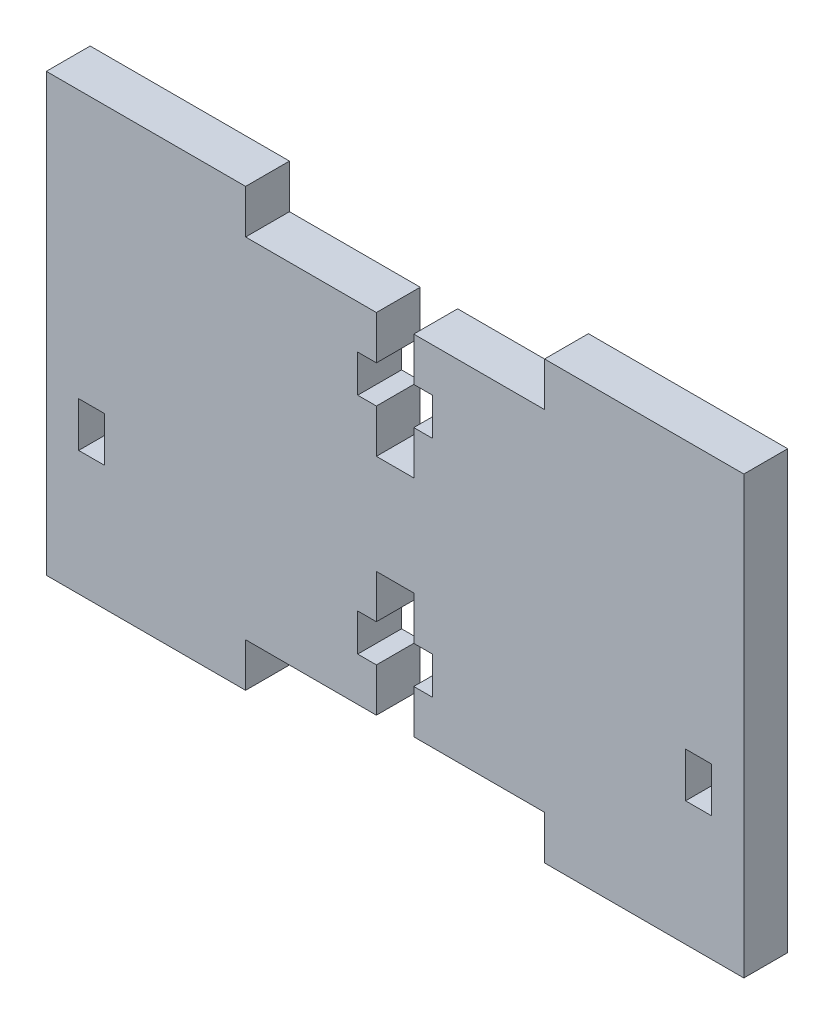
from build123d import *

# Parameters (mm, degrees)
BOSS_EXTRUDE1_DEPTH = 2.794
SKETCH2_W           = 3.302
SKETCH2_H           = 5.715
CUT_EXTRUDE1_DEPTH  = 53.731311505


with BuildPart() as part:
    # Sketch1 → Boss-Extrude1 (new, symmetric)
    with BuildSketch(Plane.XY):
        Polygon((-19.05, -27.813), (-19.05, -22.225), (-2.38125, -22.225), (-2.38125, -16.66875), (-4.7625, -16.66875), (-4.7625, -11.90625), (-2.38125, -11.90625), (-2.38125, -6.35), (2.38125, -6.35), (2.38125, -11.90625), (4.7625, -11.90625), (4.7625, -16.66875), (2.38125, -16.66875), (2.38125, -22.225), (19.05, -22.225), (19.05, -27.813), (44.45, -27.813), (44.45, -22.225), (44.45, 22.225), (44.45, 27.813), (19.05, 27.813), (19.05, 22.225), (2.38125, 22.225), (2.38125, 16.66875), (4.7625, 16.66875), (4.7625, 11.90625), (2.38125, 11.90625), (2.38125, 6.35), (-2.38125, 6.35), (-2.38125, 11.90625), (-4.7625, 11.90625), (-4.7625, 16.66875), (-2.38125, 16.66875), (-2.38125, 22.225), (-19.05, 22.225), (-19.05, 27.813), (-44.45, 27.813), (-44.45, 22.225), (-44.45, -22.225), (-44.45, -27.813), align=None)
    extrude(amount=BOSS_EXTRUDE1_DEPTH, both=True)

    # Sketch2 → Cut-Extrude1 (cut, through all)
    with BuildSketch(Plane.XY.offset(2.794)):
        with Locations((-38.675056, -9.11225)):
            Rectangle(SKETCH2_W, SKETCH2_H)
        with Locations((38.675056, -9.11225)):
            Rectangle(SKETCH2_W, SKETCH2_H)
    extrude(amount=-CUT_EXTRUDE1_DEPTH, mode=Mode.SUBTRACT)


solid = part.part
